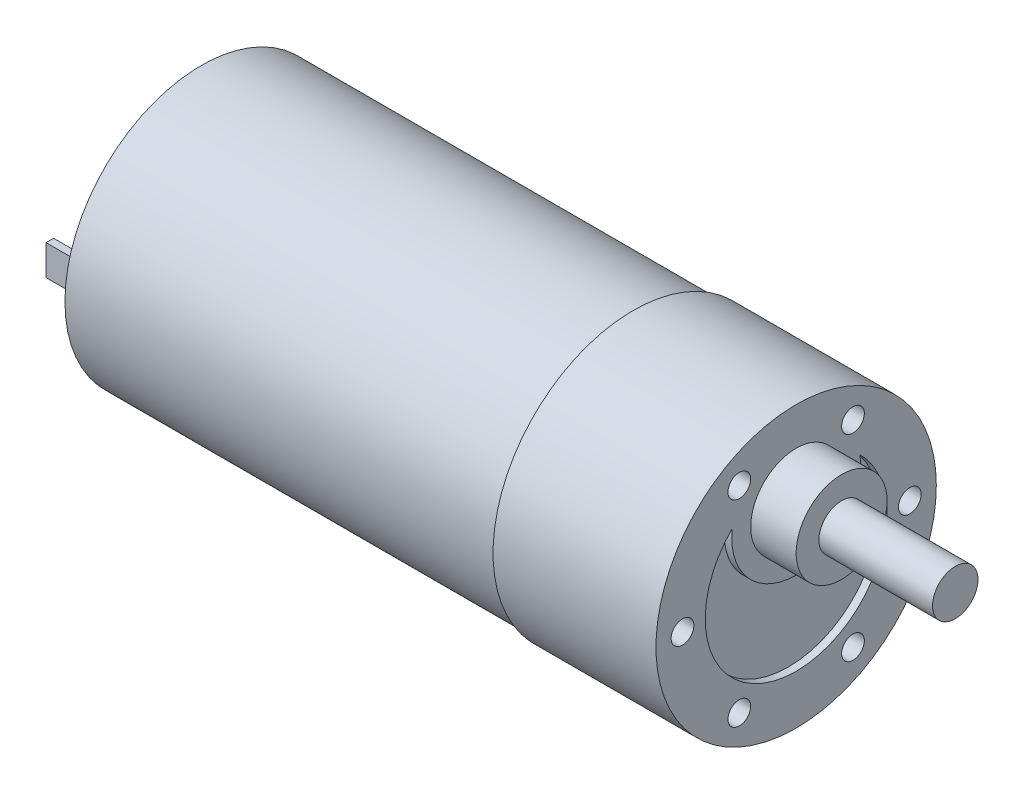
from build123d import *

# Parameters (mm, degrees)
SKETCH1_R           = 18.5
BOSS_EXTRUDE1_DEPTH = 21.5
SKETCH2_R           = 18
BOSS_EXTRUDE2_DEPTH = 57
SKETCH3_W           = 1
SKETCH3_H           = 4
BOSS_EXTRUDE3_DEPTH = 6
SKETCH4_R           = 6
BOSS_EXTRUDE4_DEPTH = 6
SKETCH5_R           = 3
BOSS_EXTRUDE5_DEPTH = 15
CUT_EXTRUDE1_DEPTH  = 1
SKETCH7_R           = 1.5
CUT_EXTRUDE2_DEPTH  = 5


with BuildPart() as part:
    # Sketch1 → Boss-Extrude1 (new body)
    with BuildSketch(Plane(origin=(0, 0, 0), x_dir=(0, 0, -1), z_dir=(1, 0, 0))):
        Circle(SKETCH1_R)
    extrude(amount=BOSS_EXTRUDE1_DEPTH)

    # Sketch2 → Boss-Extrude2 (add)
    with BuildSketch(Plane.ZY):
        with Locations(Location((0, 0, 0), (0, 0, 180))):
            Circle(SKETCH2_R)
    extrude(amount=BOSS_EXTRUDE2_DEPTH)

    # Sketch3 → Boss-Extrude3 (add)
    with BuildSketch(Plane.ZY.offset(57)):
        with Locations((-14, 0)):
            Rectangle(SKETCH3_W, SKETCH3_H)
        with Locations((14, 0)):
            Rectangle(SKETCH3_W, SKETCH3_H)
    extrude(amount=BOSS_EXTRUDE3_DEPTH)

    # Sketch4 → Boss-Extrude4 (add)
    with BuildSketch(Plane(origin=(21.5, 0, 0), x_dir=(0, 0, -1), z_dir=(1, 0, 0))):
        with Locations((0, 7.5)):
            Circle(SKETCH4_R)
    extrude(amount=BOSS_EXTRUDE4_DEPTH)

    # Sketch5 → Boss-Extrude5 (add)
    with BuildSketch(Plane(origin=(27.5, 0, 0), x_dir=(0, 0, -1), z_dir=(1, 0, 0))):
        with Locations((0, 7.5)):
            Circle(SKETCH5_R)
    extrude(amount=BOSS_EXTRUDE5_DEPTH)

    # Sketch6 → Cut-Extrude1 (cut)
    with BuildSketch(Plane(origin=(21.5, 0, 0), x_dir=(0, 0, -1), z_dir=(1, 0, 0))):
        with BuildLine():
            ThreePointArc((-8.436955744, 8.533333333), (-4.623663649, -11.073469847), (12, 0))
            ThreePointArc((12, 0), (11.073469847, 4.623663649), (8.436955744, 8.533333333))
            ThreePointArc((8.436955744, 8.533333333), (8.484224296, 8.017627365), (8.5, 7.5))
            ThreePointArc((8.5, 7.5), (-0.517627365, -0.984224296), (-8.436955744, 8.533333333))
        make_face()
    extrude(amount=-CUT_EXTRUDE1_DEPTH, mode=Mode.SUBTRACT)

    # Sketch7 → Cut-Extrude2 (cut)
    with BuildSketch(Plane(origin=(21.5, 0, 0), x_dir=(0, 0, -1), z_dir=(1, 0, 0))):
        with Locations((-15, 0)):
            Circle(SKETCH7_R)
        with Locations((-7.5, 12.990381057)):
            Circle(SKETCH7_R)
        with Locations((7.5, 12.990381057)):
            Circle(SKETCH7_R)
        with Locations((15, 0)):
            Circle(SKETCH7_R)
        with Locations((7.5, -12.990381057)):
            Circle(SKETCH7_R)
        with Locations((-7.5, -12.990381057)):
            Circle(SKETCH7_R)
    extrude(amount=-CUT_EXTRUDE2_DEPTH, mode=Mode.SUBTRACT)


solid = part.part
